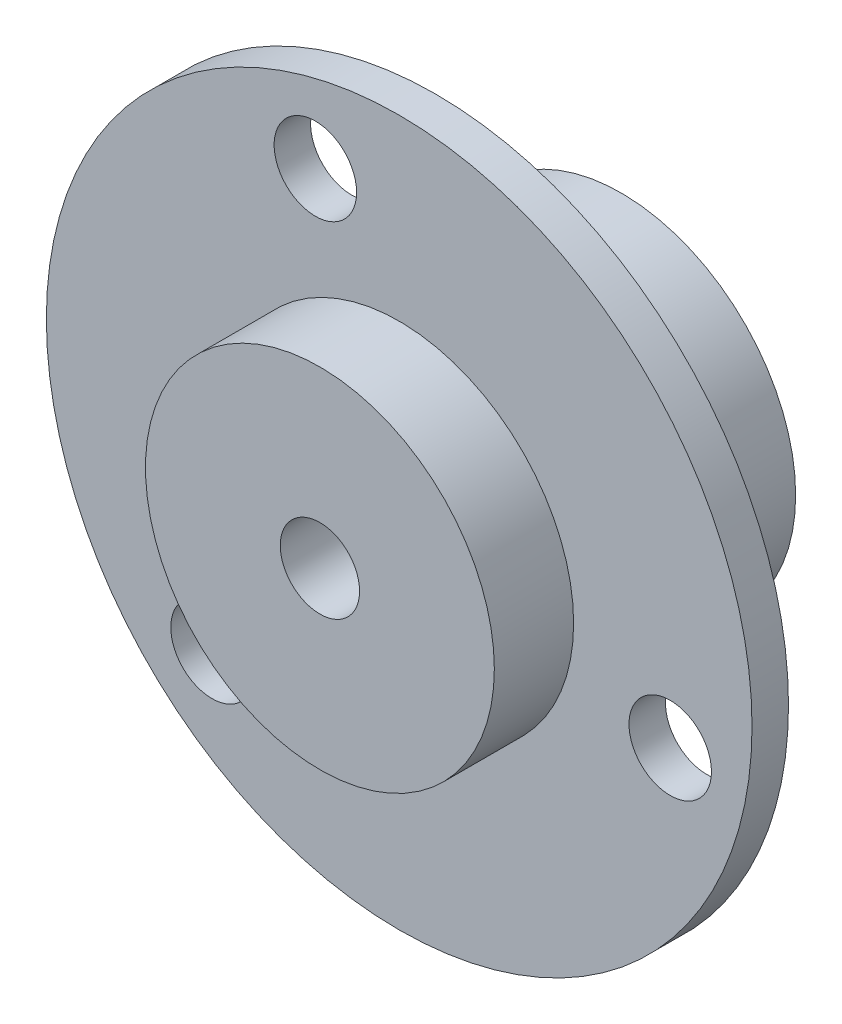
from build123d import *

# Parameters (mm, degrees)
SKETCH_1_R           = 22.25
SKETCH_1_R_2         = 2.6
SKETCH_1_R_3         = 2.5
EXTRUDE_1_DEPTH      = 2.3
EXTRUDE_2_DEPTH      = 5
EXTRUDE_2_DEPTH_BACK = 14
SKETCH_2_R           = 11
SKETCH_2_R_2         = 2.5


with BuildPart() as part:
    # 草图1 → 凸台-拉伸1 (new body)
    with BuildSketch(Plane.XY):
        with Locations((-102.009542763, 21.139729131)):
            Circle(SKETCH_1_R)
        with Locations((-84.918943057, 17.376565343)):
            Circle(SKETCH_1_R_2, mode=Mode.SUBTRACT)
        with Locations((-102.009542763, 21.139729131)):
            Circle(SKETCH_1_R_3, mode=Mode.SUBTRACT)
        with Locations((-113.813838054, 8.220417513)):
            Circle(SKETCH_1_R_2, mode=Mode.SUBTRACT)
        with Locations((-107.295847177, 37.822204536)):
            Circle(SKETCH_1_R_2, mode=Mode.SUBTRACT)
    extrude(amount=EXTRUDE_1_DEPTH)

    # 草图2 → 凸台-拉伸2 (add, two sides: drawn at the far end of the back side and taken through both)
    with BuildSketch(Plane.XY.offset(2.3).offset(-EXTRUDE_2_DEPTH_BACK)):
        with Locations((-102.009542763, 21.139729131)):
            Circle(SKETCH_2_R)
        with Locations((-102.009542763, 21.139729131)):
            Circle(SKETCH_2_R_2, mode=Mode.SUBTRACT)
    extrude(amount=EXTRUDE_2_DEPTH + EXTRUDE_2_DEPTH_BACK)


solid = part.part
